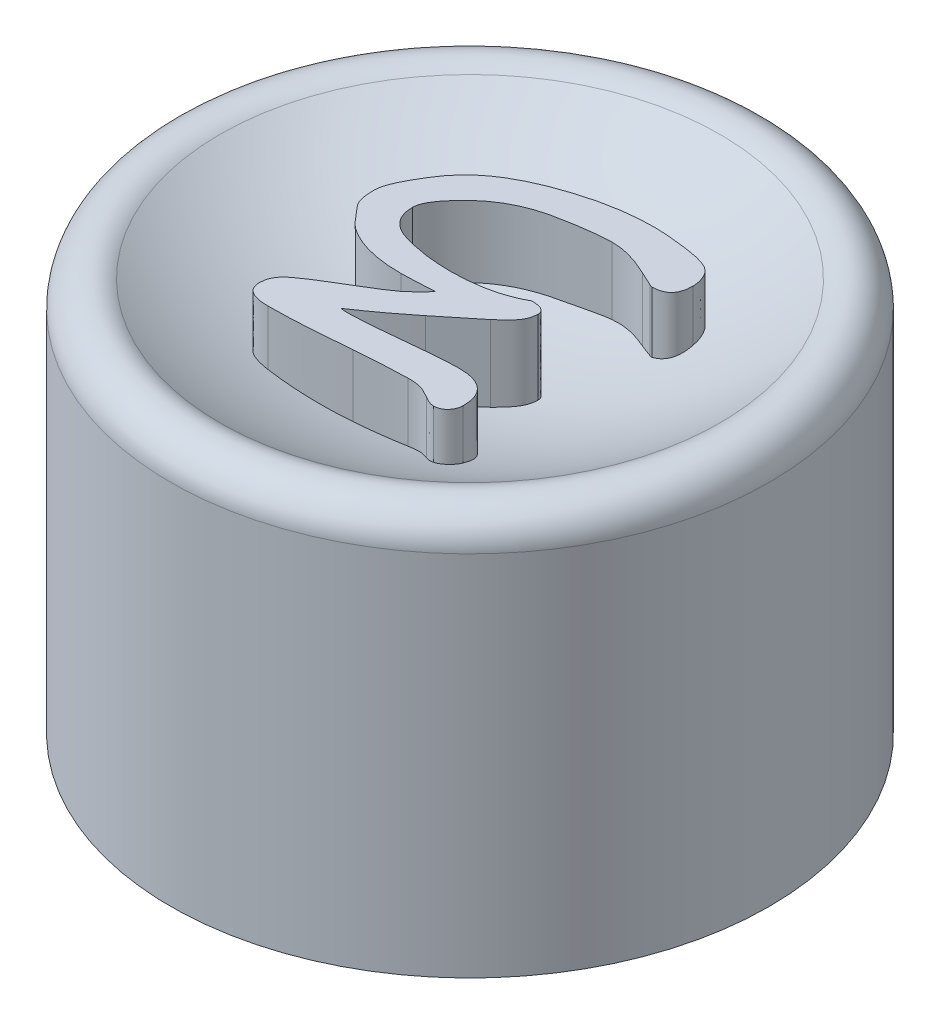
from build123d import *

# Parameters (mm, degrees)
BOSS_EXTRUDE1_REACH      = 11.257
BOSS_EXTRUDE1_END_RADIUS = 7.2532875


with BuildPart() as part:
    # Sketch1 → Revolve1 (revolve)
    with BuildSketch(Plane.XY):
        with BuildLine():
            Line((-1.5494, 0), (-1.5494, 3.048))
            Line((-1.5494, 3.048), (-0.762, 3.048))
            Line((-0.762, 3.048), (-0.762, 4.064))
            Line((-0.762, 4.064), (0, 4.064))
            Line((0, 4.064), (0, 5.08))
            ThreePointArc((0, 5.08), (-2.074697908, 5.383049508), (-3.976029965, 6.266874616))
            ThreePointArc((-3.976029965, 6.266874616), (-4.495955195, 6.288948978), (-4.7625, 5.842))
            Line((-4.7625, 5.842), (-4.7625, 0))
            Line((-4.7625, 0), (-3.4925, 0))
            Line((-3.4925, 0), (-3.4925, 4.064))
            Line((-3.4925, 4.064), (-2.0574, 4.064))
            Line((-2.0574, 4.064), (-2.0574, 0))
            Line((-2.0574, 0), (-1.5494, 0))
        make_face()
    revolve(axis=Axis((0, 0, 0), (0, -1, 0)))

    # Boss-Extrude1: up to this sphere (the profile starts inside it)
    boss_extrude1_end = Location((0, 12.3332875, 0)) * Sphere(BOSS_EXTRUDE1_END_RADIUS, mode=Mode.PRIVATE)
    # Sketch3 → Boss-Extrude1 (add, up to the surface)
    with BuildSketch(Plane(origin=(0, 6.35, 0), x_dir=(-1, 0, 0), z_dir=(0, 1, 0)), mode=Mode.PRIVATE) as boss_extrude1_sk1:
        with BuildLine():
            add(Edge.make_bspline(
                [(-0.880723398, -0.101002176), (-0.898962408, -0.100786177), (-0.933379915, -0.100378583), (-0.981326642, -0.093621238), (-1.0224988, -0.083906532), (-1.056371199, -0.06895665), (-1.08270134, -0.048929652), (-1.101198584, -0.024400161), (-1.113499784, 0.004052716), (-1.114662422, 0.024771373), (-1.115268987, 0.035580597)],
                knots=[0, 0, 0, 0, 1.434693876, 2.707306245, 3.80455808, 4.755930884, 5.601533142, 6.3778011, 7.153675314, 8, 8, 8, 8], degree=3))
            add(Edge.make_bspline(
                [(-1.115268987, 0.035580597), (-1.112615094, 0.062794181), (-1.10689558, 0.121443283), (-1.078159542, 0.196810926), (-1.035297644, 0.264986503), (-0.978840197, 0.328292533), (-0.902277318, 0.403282387), (-0.842721921, 0.455387757), (-0.810077136, 0.483948873)],
                knots=[0, 0, 0, 0, 0.876361233, 1.888681798, 2.555167027, 3.457187745, 4.606179045, 6, 6, 6, 6], degree=3))
            Line((-0.810077136, 0.483948873), (-0.23831339, 0.948330301))
            add(Edge.make_bspline(
                [(-0.23831339, 0.948330301), (-0.178218066, 0.996297864), (-0.056476112, 1.093471231), (0.132435617, 1.236885684), (0.329799273, 1.380056855), (0.466032568, 1.473015366), (0.53502769, 1.520094047)],
                knots=[0, 0, 0, 0, 0.959070548, 1.942898633, 2.958184483, 4, 4, 4, 4], degree=3))
            add(Edge.make_bspline(
                [(0.53502769, 1.520094047), (0.517465978, 1.522260505), (0.476197945, 1.527351436), (0.40469286, 1.528055984), (0.314900488, 1.525830832), (0.206832076, 1.521218414), (0.080288984, 1.512467389), (-0.064410914, 1.499871729), (-0.227744261, 1.48506694), (-0.342572301, 1.472848984), (-0.403154668, 1.466402888)],
                knots=[0, 0, 0, 0, 0.450970887, 1.059730506, 1.820585234, 2.742285805, 3.817671041, 5.055169139, 6.446330501, 8, 8, 8, 8], degree=3))
            add(Edge.make_bspline(
                [(-0.403154668, 1.466402888), (-0.450571945, 1.461752059), (-0.541644213, 1.452819418), (-0.67245845, 1.439042451), (-0.792448471, 1.428771206), (-0.901147753, 1.42078542), (-0.998697984, 1.412407772), (-1.085413116, 1.408037714), (-1.161087902, 1.404911511), (-1.207891588, 1.404446384), (-1.229244956, 1.404234177)],
                knots=[0, 0, 0, 0, 1.379829519, 2.650177532, 3.809336138, 4.867315987, 5.806735196, 6.644543091, 7.381596342, 8, 8, 8, 8], degree=3))
            add(Edge.make_bspline(
                [(-1.229244956, 1.404234177), (-1.272375716, 1.405464421), (-1.353351723, 1.407774145), (-1.466452605, 1.430267182), (-1.562938144, 1.467560867), (-1.642702694, 1.521253151), (-1.705200107, 1.591374011), (-1.748664971, 1.677351793), (-1.774294253, 1.77799147), (-1.776981988, 1.849615922), (-1.778401899, 1.887454608)],
                knots=[0, 0, 0, 0, 1.235012122, 2.318678174, 3.287938556, 4.181552475, 5.048485316, 5.950084332, 6.917044169, 8, 8, 8, 8], degree=3))
            add(Edge.make_bspline(
                [(-1.778401899, 1.887454608), (-1.777900603, 1.902967357), (-1.77690902, 1.933652158), (-1.762212765, 1.977202524), (-1.7428538, 2.019170419), (-1.713288208, 2.05575833), (-1.679398511, 2.088028516), (-1.63980192, 2.111258365), (-1.596225723, 2.124889587), (-1.565931393, 2.126717681), (-1.55044996, 2.127651899)],
                knots=[0, 0, 0, 0, 1.008870765, 1.995584395, 2.977592231, 4.016081471, 5.047245853, 6.022152411, 6.989252652, 8, 8, 8, 8], degree=3))
            add(Edge.make_bspline(
                [(-1.55044996, 2.127651899), (-1.537825118, 2.126821541), (-1.510877179, 2.125049127), (-1.468917139, 2.112825726), (-1.423673393, 2.092618109), (-1.393291862, 2.074905166), (-1.377131131, 2.065483188)],
                knots=[0, 0, 0, 0, 0.813182387, 1.735751589, 2.795587082, 4, 4, 4, 4], degree=3))
            add(Edge.make_bspline(
                [(-1.377131131, 2.065483188), (-1.357083745, 2.054098646), (-1.319450867, 2.032727625), (-1.266455314, 2.004221158), (-1.219862421, 1.983182238), (-1.177843041, 1.967616473), (-1.134474037, 1.957826332), (-1.084944164, 1.951851126), (-1.027142705, 1.946686753), (-0.985608335, 1.946759139), (-0.963615012, 1.946797468)],
                knots=[0, 0, 0, 0, 1.263374843, 2.37160254, 3.295726418, 4.06304316, 4.822605113, 5.725340337, 6.795519886, 8, 8, 8, 8], degree=3))
            add(Edge.make_bspline(
                [(-0.963615012, 1.946797468), (-0.94257786, 1.947081285), (-0.896730524, 1.947699822), (-0.822292066, 1.949402112), (-0.735975357, 1.953685701), (-0.637662231, 1.957998744), (-0.527452699, 1.964737526), (-0.405668202, 1.97350843), (-0.271905459, 1.982847091), (-0.178655709, 1.989487454), (-0.129989122, 1.992953026)],
                knots=[0, 0, 0, 0, 0.604689596, 1.317830829, 2.139827145, 3.088443188, 4.146164079, 5.313117269, 6.597729092, 8, 8, 8, 8], degree=3))
            add(Edge.make_bspline(
                [(-0.129989122, 1.992953026), (-0.065321116, 1.999058211), (0.060819424, 2.010966903), (0.245142198, 2.026024576), (0.419444562, 2.038109014), (0.583658706, 2.04848302), (0.737800525, 2.057368524), (0.881957458, 2.06262225), (1.015709644, 2.067005387), (1.101450404, 2.067249819), (1.142585542, 2.067367089)],
                knots=[0, 0, 0, 0, 1.222522247, 2.38463542, 3.480587211, 4.510891409, 5.481506263, 6.38635342, 7.225834067, 8, 8, 8, 8], degree=3))
            add(Edge.make_bspline(
                [(1.142585542, 2.067367089), (1.173405305, 2.066842304), (1.231244828, 2.065857441), (1.311916774, 2.053598218), (1.380662161, 2.034357146), (1.437984533, 2.007328744), (1.48304138, 1.970718468), (1.515253005, 1.92519609), (1.53345686, 1.871157221), (1.535958406, 1.832957218), (1.537262658, 1.813040546)],
                knots=[0, 0, 0, 0, 1.392505101, 2.613317642, 3.678123722, 4.611488998, 5.458588171, 6.273920353, 7.100058613, 8, 8, 8, 8], degree=3))
            add(Edge.make_bspline(
                [(1.537262658, 1.813040546), (1.535223976, 1.783898757), (1.531166297, 1.725896584), (1.499551577, 1.642651792), (1.44640217, 1.567599203), (1.372921462, 1.499133829), (1.279987738, 1.433358715), (1.17149471, 1.35977684), (1.045466973, 1.278444997), (0.953784987, 1.224592784), (0.905214102, 1.196063192)],
                knots=[0, 0, 0, 0, 0.756199082, 1.505095998, 2.279356761, 3.127870258, 4.102366281, 5.236452016, 6.535939525, 8, 8, 8, 8], degree=3))
            add(Edge.make_bspline(
                [(0.905214102, 1.196063192), (0.87253938, 1.176945094), (0.809608022, 1.140123729), (0.719165341, 1.086453322), (0.636302784, 1.036481327), (0.560995683, 0.990741084), (0.493878775, 0.947730474), (0.433772854, 0.909794429), (0.381826728, 0.874653736), (0.321840682, 0.832913653), (0.252332145, 0.778702212), (0.17162795, 0.706176714), (0.091016773, 0.624776146), (0.039533942, 0.565267883), (0.013187302, 0.534814181)],
                knots=[0, 0, 0, 0, 1.21979001, 2.349309731, 3.388597093, 4.337700838, 5.188122851, 5.957074196, 6.627696051, 7.208691864, 8.311620137, 9.465169161, 10.702785509, 12, 12, 12, 12], degree=3))
            add(Edge.make_bspline(
                [(0.013187302, 0.534814181), (0.067807412, 0.538792228), (0.169781728, 0.546219138), (0.312374466, 0.553520397), (0.433262111, 0.558657306), (0.5067655, 0.55975461), (0.539737441, 0.560246835)],
                knots=[0, 0, 0, 0, 1.246385793, 2.326969682, 3.249516837, 4, 4, 4, 4], degree=3))
            add(Edge.make_bspline(
                [(0.539737441, 0.560246835), (0.601653262, 0.559444336), (0.721088173, 0.557896324), (0.893260008, 0.538150069), (1.052379296, 0.509056231), (1.197189529, 0.466442716), (1.327139011, 0.415545592), (1.439942133, 0.355766181), (1.537392017, 0.29075905), (1.613493801, 0.214842159), (1.676815305, 0.140642773), (1.735383032, 0.075816374), (1.78208966, 0.015500717), (1.827174635, -0.036587665), (1.861980594, -0.097607933), (1.884570468, -0.174942075), (1.896473606, -0.270802745), (1.898092583, -0.34084941), (1.898971519, -0.378877472)],
                knots=[0, 0, 0, 0, 1.613417691, 3.112264225, 4.512261979, 5.825646698, 7.041750312, 8.143995354, 9.149958581, 10.08206503, 10.934564328, 11.694642174, 12.358174272, 12.923255271, 13.487802363, 14.173926056, 15.008631553, 16, 16, 16, 16], degree=3))
            add(Edge.make_bspline(
                [(1.898971519, -0.378877472), (1.897999793, -0.398113841), (1.895903509, -0.439612059), (1.878949533, -0.505062411), (1.854501645, -0.578399186), (1.8200267, -0.659889773), (1.775268033, -0.74911292), (1.721400329, -0.847064497), (1.658239862, -0.953430956), (1.58609085, -1.066451476), (1.502609702, -1.180921972), (1.405156122, -1.290342128), (1.294969674, -1.393500351), (1.172221783, -1.490718077), (1.035740734, -1.581076282), (0.886646442, -1.665535796), (0.72543695, -1.744837245), (0.553585042, -1.816028402), (0.376191099, -1.880404192), (0.197592463, -1.936607843), (0.020266141, -1.985371952), (-0.156337265, -2.02337691), (-0.331177483, -2.055102627), (-0.505370485, -2.076867354), (-0.678343048, -2.089010799), (-0.793418467, -2.091198228), (-0.850580993, -2.09228481)],
                knots=[0, 0, 0, 0, 0.395661363, 0.853552046, 1.385064083, 1.987761896, 2.672945506, 3.439617545, 4.288866436, 5.219517817, 6.199577588, 7.202419992, 8.231424677, 9.303628022, 10.422428569, 11.597914545, 12.829529978, 14.118964928, 15.425720172, 16.713776958, 17.973041674, 19.210631544, 20.431819765, 21.63055776, 22.82300404, 24, 24, 24, 24], degree=3))
            add(Edge.make_bspline(
                [(-0.850580993, -2.09228481), (-0.887016598, -2.091676498), (-0.967523509, -2.090332393), (-1.09885281, -2.080143196), (-1.251974328, -2.063300106), (-1.390977046, -2.047326689), (-1.505200427, -2.029206507), (-1.58504033, -2.013852785), (-1.655404111, -1.993997198), (-1.717003358, -1.972211404), (-1.770635023, -1.949645048), (-1.813997981, -1.921678882), (-1.8502144, -1.893070051), (-1.883331134, -1.849650791), (-1.912552709, -1.793605845), (-1.940230437, -1.726346353), (-1.955378592, -1.657766552), (-1.957972674, -1.611953537), (-1.959256329, -1.589283426)],
                knots=[0, 0, 0, 0, 1.284722113, 2.838679601, 4.642109223, 6.717090522, 7.770977615, 8.719837137, 9.582134829, 10.345505744, 11.024486847, 11.62653563, 12.160957202, 12.641643451, 13.538502374, 14.383497074, 15.200089731, 16, 16, 16, 16], degree=3))
            add(Edge.make_bspline(
                [(-1.959256329, -1.589283426), (-1.958610341, -1.562495647), (-1.957397373, -1.512196426), (-1.941728872, -1.441951834), (-1.918092076, -1.381318741), (-1.882362653, -1.331814744), (-1.836309918, -1.293622994), (-1.780216879, -1.26741012), (-1.714617055, -1.251167687), (-1.667670395, -1.249292447), (-1.642761076, -1.248297468)],
                knots=[0, 0, 0, 0, 1.203828438, 2.260420111, 3.224001613, 4.114823438, 4.978298921, 5.888872341, 6.879861668, 8, 8, 8, 8], degree=3))
            add(Edge.make_bspline(
                [(-1.642761076, -1.248297468), (-1.636409628, -1.249660918), (-1.619578576, -1.253274), (-1.604259693, -1.261236678), (-1.594721618, -1.266194521)],
                knots=[0, 0, 0, 0, 0.754729673, 2, 2, 2, 2], degree=3))
            Line((-1.594721618, -1.266194521), (-1.374305281, -1.367925138))
            add(Edge.make_bspline(
                [(-1.374305281, -1.367925138), (-1.315441686, -1.395465239), (-1.202217904, -1.44843846), (-1.031312081, -1.506160156), (-0.867822143, -1.542585472), (-0.760950828, -1.547396051), (-0.709288469, -1.549721519)],
                knots=[0, 0, 0, 0, 1.12101712, 2.156269894, 3.108727664, 4, 4, 4, 4], degree=3))
            add(Edge.make_bspline(
                [(-0.709288469, -1.549721519), (-0.686049337, -1.549232114), (-0.636393604, -1.548186387), (-0.557813315, -1.543522553), (-0.47057269, -1.534501482), (-0.375093164, -1.523335127), (-0.270795893, -1.509129405), (-0.158039859, -1.491283369), (-0.036665693, -1.469095905), (0.091573661, -1.445853073), (0.221538391, -1.416828242), (0.348089697, -1.379121661), (0.468713412, -1.333615594), (0.584691701, -1.282015471), (0.694395687, -1.221330376), (0.79994544, -1.154713695), (0.898606711, -1.078640325), (0.991437415, -0.997832515), (1.075829844, -0.915502444), (1.149095888, -0.834864235), (1.213319957, -0.760336191), (1.263478889, -0.68819216), (1.305949708, -0.622402866), (1.33389017, -0.559038707), (1.35261804, -0.500188761), (1.355195914, -0.461885264), (1.356408228, -0.443872033)],
                knots=[0, 0, 0, 0, 0.668258995, 1.427888511, 2.262358202, 3.189485983, 4.191671213, 5.288433286, 6.471310543, 7.738985728, 9.035391584, 10.297784498, 11.531843563, 12.739908285, 13.943783487, 15.133255998, 16.324884624, 17.521426921, 18.670476711, 19.711899907, 20.653894766, 21.49551156, 22.23711929, 22.899806556, 23.482605008, 24, 24, 24, 24], degree=3))
            add(Edge.make_bspline(
                [(1.356408228, -0.443872033), (1.355421609, -0.415522886), (1.353527388, -0.361095004), (1.336236346, -0.282917842), (1.306832671, -0.212439538), (1.26567389, -0.149220291), (1.212925227, -0.093776358), (1.148439961, -0.046653026), (1.07343714, -0.005344829), (0.955665302, 0.035458678), (0.796882588, 0.075808107), (0.596885272, 0.113503217), (0.385981728, 0.13352397), (0.24211883, 0.136653875), (0.168609078, 0.138253165)],
                knots=[0, 0, 0, 0, 0.69145858, 1.327539945, 1.942578661, 2.546432168, 3.159173454, 3.800040913, 4.489542009, 5.241421496, 6.834924304, 8.487356586, 10.205141502, 12, 12, 12, 12], degree=3))
            add(Edge.make_bspline(
                [(0.168609078, 0.138253165), (0.11740894, 0.137557575), (0.017077473, 0.136194503), (-0.130419459, 0.124673344), (-0.271240468, 0.105837586), (-0.406096596, 0.080821777), (-0.534200531, 0.046940332), (-0.655938994, 0.004861789), (-0.772493756, -0.041793775), (-0.844963236, -0.081439124), (-0.880723398, -0.101002176)],
                knots=[0, 0, 0, 0, 1.129121063, 2.212618487, 3.260566932, 4.261540429, 5.235782809, 6.179647994, 7.101744856, 8, 8, 8, 8], degree=3))
        make_face()
    boss_extrude1_tool1 = extrude(boss_extrude1_sk1.sketch, amount=-BOSS_EXTRUDE1_REACH, mode=Mode.PRIVATE) & boss_extrude1_end
    add(boss_extrude1_tool1.solids().sort_by_distance((1.010477, 6.35, -0.026213))[0])


solid = part.part
